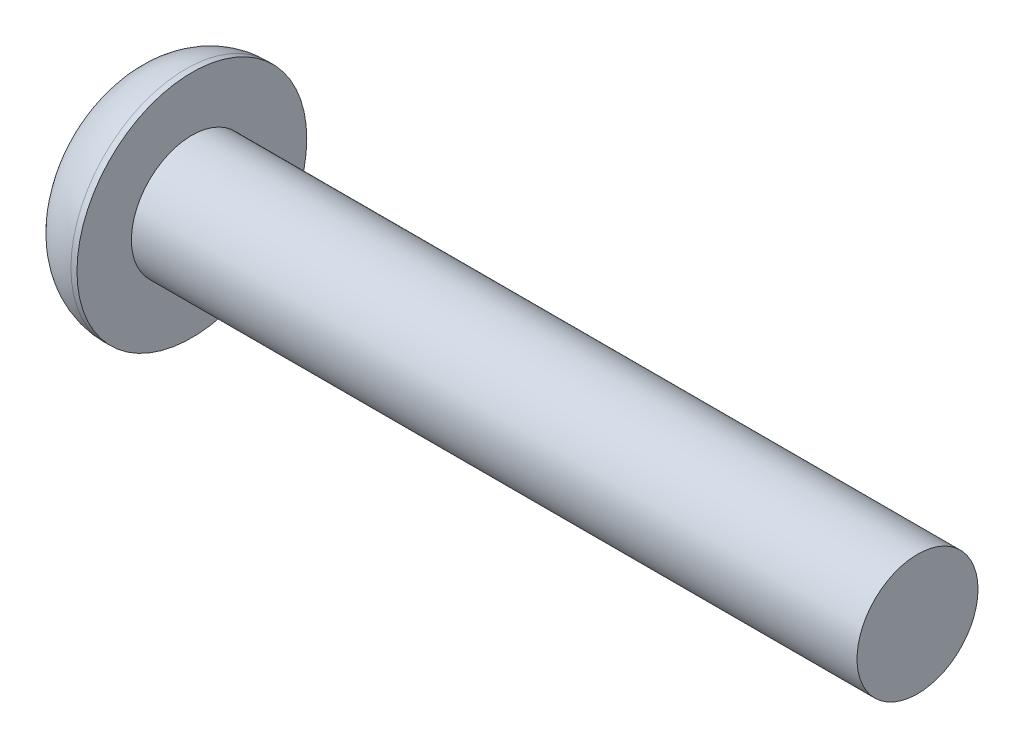
from build123d import *

# Parameters (mm, degrees)
CUT_EXTRUDE1_DEPTH = 1.04


with BuildPart() as part:
    # Sketch1 → Revolve1 (revolve)
    with BuildSketch(Plane(origin=(0, 0, 0), x_dir=(1, 0, 0), z_dir=(0, 1, 0))):
        with BuildLine():
            Line((0, 0), (19.65, 0))
            Line((19.65, 0), (19.65, 1.5))
            Line((19.65, 1.5), (1.65, 1.5))
            Line((1.65, 1.5), (1.65, 2.85))
            Line((1.65, 2.85), (1.5, 2.85))
            ThreePointArc((1.5, 2.85), (0.439339828, 2.410660172), (0, 1.35))
            Line((0, 1.35), (0, 0))
        make_face()
    revolve(axis=Axis((0, 0, 0), (-1, 0, 0)))

    # Sketch2 → Cut-Extrude1 (cut)
    with BuildSketch(Plane.ZY):
        Polygon((1.154700538, 0), (0.577350269, 1), (-0.577350269, 1), (-1.154700538, 0), (-0.577350269, -1), (0.577350269, -1), align=None)
    extrude(amount=-CUT_EXTRUDE1_DEPTH, mode=Mode.SUBTRACT)


solid = part.part
